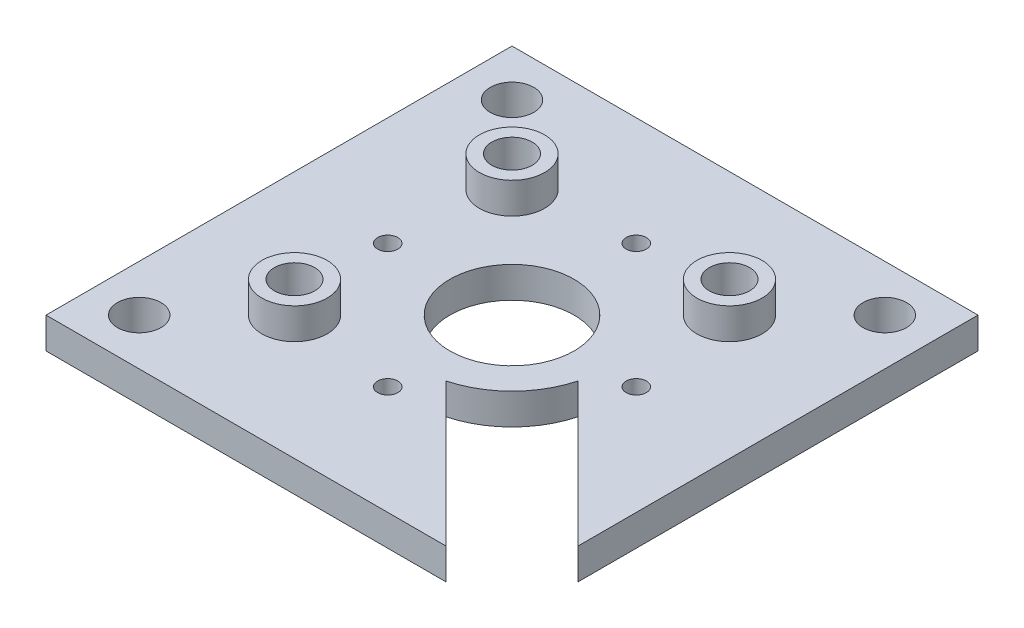
from build123d import *

# Parameters (mm, degrees)
SKETCH_1_W          = 30
SKETCH_1_H          = 30
SKETCH_1_R          = 0.65
SKETCH_1_R_2        = 4
SKETCH_1_R_3        = 1.4
EXTRUDE_1_DEPTH     = 2
SKETCH_2_R          = 2.1
SKETCH_2_R_2        = 1.3
EXTRUDE_3_DEPTH     = 2
CUT_EXTRUDE_START   = -2
SKETCH_2_6_R        = 1.3
SKETCH_2_6_R_2      = 1.4
SKETCH_2_6_R_3      = 2.1
CUT_EXTRUDE_2_DEPTH = 2


with BuildPart() as part:
    # 草图1 → 凸台-拉伸1 (new body)
    with BuildSketch(Plane(origin=(0, 0, 0), x_dir=(1, 0, 0), z_dir=(0, 1, 0))):
        Rectangle(SKETCH_1_W, SKETCH_1_H)
        with Locations(Location((8, 0, 0), (0, 0, 270))):
            Circle(SKETCH_1_R, mode=Mode.SUBTRACT)
        with Locations(Location((0, -8, 0), (0, 0, 270))):
            Circle(SKETCH_1_R, mode=Mode.SUBTRACT)
        with Locations(Location((-8, 0, 0), (0, 0, 270))):
            Circle(SKETCH_1_R, mode=Mode.SUBTRACT)
        with Locations(Location((0, 8, 0), (0, 0, 270))):
            Circle(SKETCH_1_R, mode=Mode.SUBTRACT)
        with Locations(Location((0, 0, 0), (0, 0, 270))):
            Circle(SKETCH_1_R_2, mode=Mode.SUBTRACT)
        with Locations(Location((12, 12, 0), (0, 0, 270))):
            Circle(SKETCH_1_R_3, mode=Mode.SUBTRACT)
        with Locations(Location((-12, 12, 0), (0, 0, 270))):
            Circle(SKETCH_1_R_3, mode=Mode.SUBTRACT)
        with Locations(Location((12, -12, 0), (0, 0, 270))):
            Circle(SKETCH_1_R_3, mode=Mode.SUBTRACT)
        with Locations(Location((-12, -12, 0), (0, 0, 270))):
            Circle(SKETCH_1_R_3, mode=Mode.SUBTRACT)
    extrude(amount=EXTRUDE_1_DEPTH)

    # 草图2 → 凸台-拉伸3 (add)
    # profile 1 of 3: a face of its own
    with BuildSketch(Plane(origin=(0, 2, 0), x_dir=(1, 0, 0), z_dir=(0, 1, 0))):
        with Locations(Location((-7, -7, 0), (0, 0, 270))):
            Circle(SKETCH_2_R)
        with Locations(Location((-7, -7, 0), (0, 0, 270))):
            Circle(SKETCH_2_R_2, mode=Mode.SUBTRACT)
    # profile 2 of 3: a face of its own
    with BuildSketch(Plane(origin=(0, 2, 0), x_dir=(1, 0, 0), z_dir=(0, 1, 0))):
        with Locations(Location((-7, 7, 0), (0, 0, 270))):
            Circle(SKETCH_2_R)
        with Locations(Location((-7, 7, 0), (0, 0, 270))):
            Circle(SKETCH_2_R_2, mode=Mode.SUBTRACT)
    # profile 3 of 3: a face of its own
    with BuildSketch(Plane(origin=(0, 2, 0), x_dir=(1, 0, 0), z_dir=(0, 1, 0))):
        with Locations(Location((7, 7, 0), (0, 0, 270))):
            Circle(SKETCH_2_R)
        with Locations(Location((7, 7, 0), (0, 0, 270))):
            Circle(SKETCH_2_R_2, mode=Mode.SUBTRACT)
    extrude(amount=EXTRUDE_3_DEPTH)

    # 草图2<6> → 切除-拉伸2 (cut)
    # profile 1 of 6: a face of its own
    with BuildSketch(Plane(origin=(0, 2, 0), x_dir=(1, 0, 0), z_dir=(0, 1, 0)).offset(CUT_EXTRUDE_START)):
        with Locations(Location((-7, 7, 0), (0, 0, 270))):
            Circle(SKETCH_2_6_R)
    # profile 2 of 6: a face of its own
    with BuildSketch(Plane(origin=(0, 2, 0), x_dir=(1, 0, 0), z_dir=(0, 1, 0)).offset(CUT_EXTRUDE_START)):
        with Locations(Location((-7, -7, 0), (0, 0, 270))):
            Circle(SKETCH_2_6_R)
    # profile 3 of 6: a face of its own
    with BuildSketch(Plane(origin=(0, 2, 0), x_dir=(1, 0, 0), z_dir=(0, 1, 0)).offset(CUT_EXTRUDE_START)):
        with Locations(Location((7, 7, 0), (0, 0, 270))):
            Circle(SKETCH_2_6_R)
    # profile 4 of 6: a face of its own
    with BuildSketch(Plane(origin=(0, 2, 0), x_dir=(1, 0, 0), z_dir=(0, 1, 0)).offset(CUT_EXTRUDE_START)):
        with BuildLine():
            Line((15, -10.757359313), (5.795554958, -1.552914271))
            ThreePointArc((5.795554958, -1.552914271), (4.242640687, -4.242640687), (1.552914271, -5.795554958))
            Line((1.552914271, -5.795554958), (10.757359313, -15))
            Line((10.757359313, -15), (15, -15))
            Line((15, -15), (15, -10.757359313))
        make_face()
        with Locations((12, -12)):
            Circle(SKETCH_2_6_R_2, mode=Mode.SUBTRACT)
        with Locations((7, -7)):
            Circle(SKETCH_2_6_R_3, mode=Mode.SUBTRACT)
    # profile 5 of 6: a face of its own
    with BuildSketch(Plane(origin=(0, 2, 0), x_dir=(1, 0, 0), z_dir=(0, 1, 0)).offset(CUT_EXTRUDE_START)):
        with Locations((7, -7)):
            Circle(SKETCH_2_6_R_3)
        with Locations((7, -7)):
            Circle(SKETCH_2_6_R, mode=Mode.SUBTRACT)
    # profile 6 of 6: a face of its own
    with BuildSketch(Plane(origin=(0, 2, 0), x_dir=(1, 0, 0), z_dir=(0, 1, 0)).offset(CUT_EXTRUDE_START)):
        with Locations((7, -7)):
            Circle(SKETCH_2_6_R)
    extrude(amount=CUT_EXTRUDE_2_DEPTH, mode=Mode.SUBTRACT)


solid = part.part
